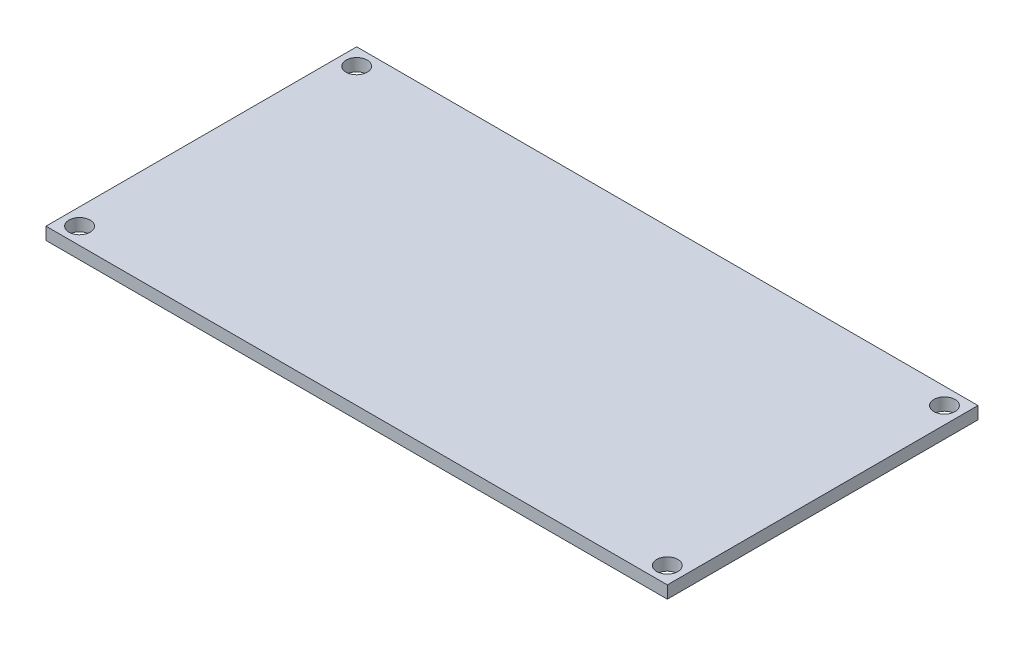
from build123d import *

# Parameters (mm, degrees)
SKETCH_1_W          = 100
SKETCH_1_H          = 50
EXTRUDE_1_DEPTH     = 2
SKETCH_2_R          = 1.7
CUT_EXTRUDE_1_DEPTH = 56.937465084


with BuildPart() as part:
    # 스케치1 → 보스-돌출1 (new body)
    with BuildSketch(Plane(origin=(0, 0, 0), x_dir=(1, 0, 0), z_dir=(0, 1, 0))):
        Rectangle(SKETCH_1_W, SKETCH_1_H)
    extrude(amount=EXTRUDE_1_DEPTH)

    # 스케치2 → 컷-돌출1 (cut, through all)
    with BuildSketch(Plane(origin=(0, 2, 0), x_dir=(1, 0, 0), z_dir=(0, 1, 0))):
        with Locations(Location((47.3, 22.3, 0), (0, 0, 270))):
            Circle(SKETCH_2_R)
        with Locations(Location((47.3, -22.3, 0), (0, 0, 90))):
            Circle(SKETCH_2_R)
        with Locations(Location((-47.3, -22.3, 0), (0, 0, 270))):
            Circle(SKETCH_2_R)
        with Locations(Location((-47.3, 22.3, 0), (0, 0, 90))):
            Circle(SKETCH_2_R)
    extrude(amount=-CUT_EXTRUDE_1_DEPTH, mode=Mode.SUBTRACT)


solid = part.part
